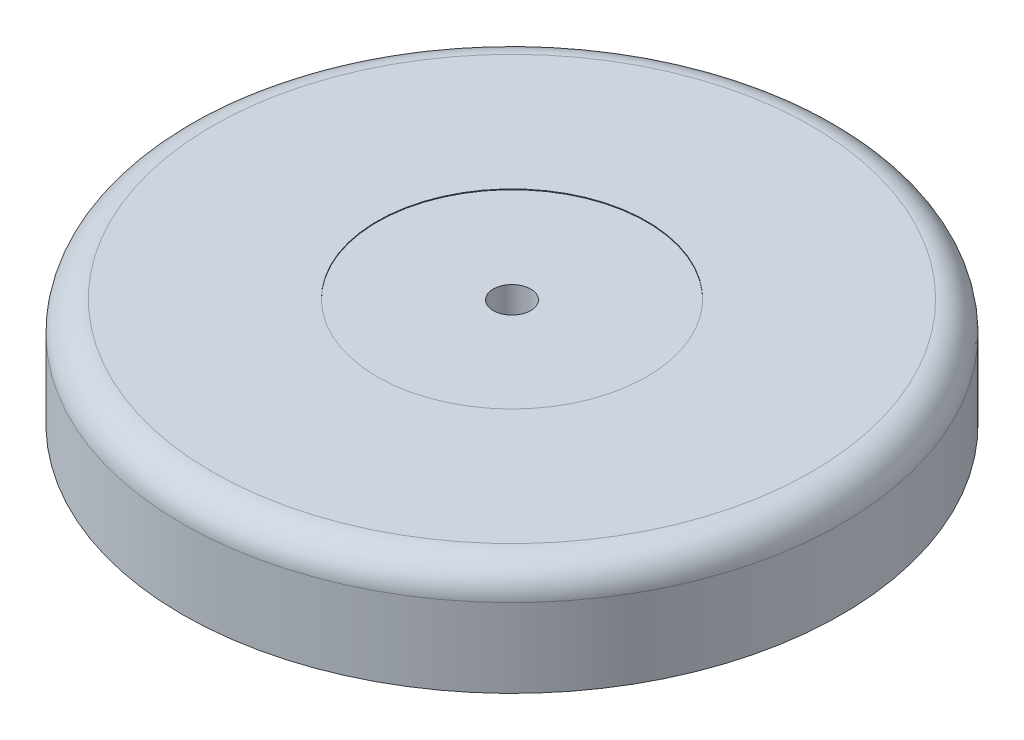
from build123d import *

# Parameters (mm, degrees)
SKETCH1_R           = 44
BOSS_EXTRUDE1_DEPTH = 14.5
FILLET1_R           = 4
SKETCH2_R           = 18
CUT_EXTRUDE1_DEPTH  = 0.1
SKETCH3_R           = 2.5
CUT_EXTRUDE2_DEPTH  = 64.869867838
SKETCH4_R           = 7.5
SKETCH4_R_2         = 2.5
BOSS_EXTRUDE2_DEPTH = 9.3
CUT_EXTRUDE3_START  = -0.1
SKETCH4_3_R         = 18
SKETCH4_3_R_2       = 7.5
CUT_EXTRUDE3_DEPTH  = 0.1


with BuildPart() as part:
    # Sketch1 → Boss-Extrude1 (new body)
    with BuildSketch(Plane(origin=(0, 0, 0), x_dir=(1, 0, 0), z_dir=(0, 1, 0))):
        Circle(SKETCH1_R)
    extrude(amount=BOSS_EXTRUDE1_DEPTH)

    # Fillet1
    fillet1_edges = [part.edges().sort_by_distance(p)[0] for p in [
        (-44, 14.5, 0),
    ]]
    fillet(fillet1_edges, radius=FILLET1_R)

    # Sketch2 → Cut-Extrude1 (cut)
    with BuildSketch(Plane(origin=(0, 14.5, 0), x_dir=(1, 0, 0), z_dir=(0, 1, 0))):
        Circle(SKETCH2_R)
    extrude(amount=-CUT_EXTRUDE1_DEPTH, mode=Mode.SUBTRACT)

    # Sketch3 → Cut-Extrude2 (cut, through all)
    with BuildSketch(Plane(origin=(0, 14.4, 0), x_dir=(1, 0, 0), z_dir=(0, 1, 0))):
        Circle(SKETCH3_R)
    extrude(amount=-CUT_EXTRUDE2_DEPTH, mode=Mode.SUBTRACT)

    # Sketch4 → Boss-Extrude2 (add)
    with BuildSketch(Plane.XZ):
        Circle(SKETCH4_R)
        Circle(SKETCH4_R_2, mode=Mode.SUBTRACT)
    extrude(amount=BOSS_EXTRUDE2_DEPTH)

    # Sketch4<3> → Cut-Extrude3 (cut)
    with BuildSketch(Plane.XZ.offset(CUT_EXTRUDE3_START)):
        Circle(SKETCH4_3_R)
        Circle(SKETCH4_3_R_2, mode=Mode.SUBTRACT)
    extrude(amount=CUT_EXTRUDE3_DEPTH, mode=Mode.SUBTRACT)


solid = part.part
